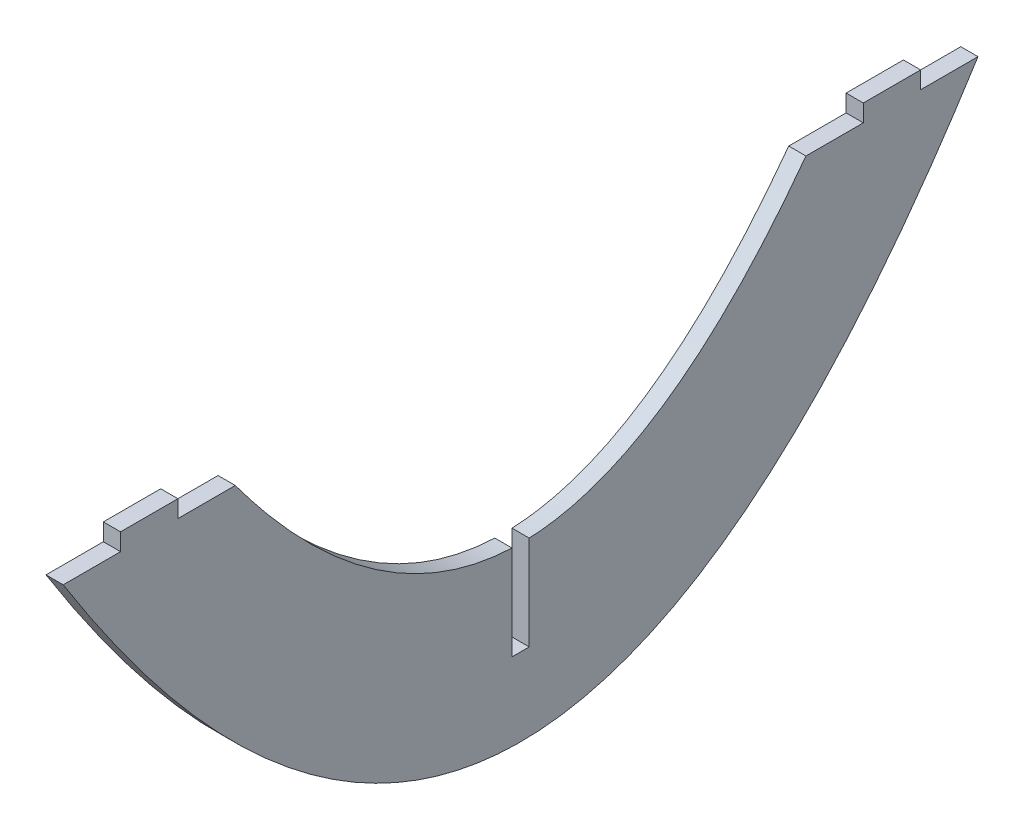
from build123d import *

# Parameters (mm, degrees)
EXTRUDE_1_DEPTH     = 3
EXTRUDE_2_DEPTH     = 3
CUT_EXTRUDE_1_DEPTH = 173.564004098


with BuildPart() as part:
    # 草图1 → 凸台-拉伸1 (new body)
    with BuildSketch(Plane(origin=(0, 0, 0), x_dir=(0, 0, -1), z_dir=(1, 0, 0))):
        with BuildLine():
            Line((-79.7507074, 150.000523308), (-49.751094174, 150.000523308))
            add(Edge.make_bspline(
                [(-49.751094174, 150.000523308), (0, 82.797016692), (49.751094174, 150.000523308)],
                knots=[0.222336685, 0.222336685, 0.222336685, 0.777663315, 0.777663315, 0.777663315], degree=2))
            Line((49.751094174, 150.000523308), (79.7507074, 150.000523308))
            add(Edge.make_bspline(
                [(-79.7507074, 150.000523308), (0, 22.797016692), (79.7507074, 150.000523308)],
                knots=[0.059549815, 0.059549815, 0.059549815, 0.940450185, 0.940450185, 0.940450185], degree=2))
        make_face()
    extrude(amount=EXTRUDE_1_DEPTH)

    # 草图2 → 凸台-拉伸2 (add)
    with BuildSketch(Plane(origin=(0, 150.000523308, 0), x_dir=(1, 0, 0), z_dir=(0, 1, 0))):
        Polygon((3, -59.750900787), (0.999993554, -59.750900787), (2.000006446, -69.750900787), (3, -69.750900787), align=None)
        Polygon((2.000006446, -69.750900787), (0.999993554, -59.750900787), (0, -59.750900787), (0, -69.750900787), align=None)
        Polygon((2.000006446, 59.750900787), (0.999993554, 69.750900787), (0, 69.750900787), (0, 59.750900787), align=None)
        Polygon((3, 69.750900787), (0.999993554, 69.750900787), (2.000006446, 59.750900787), (3, 59.750900787), align=None)
    extrude(amount=EXTRUDE_2_DEPTH)

    # 草图3 → 切除-拉伸1 (cut, through all)
    with BuildSketch(Plane.ZY):
        with BuildLine():
            Line((-1.5, 116.429314933), (-1.5, 99.990363817))
            Line((-1.5, 99.990363817), (1.5, 99.990363817))
            Line((1.5, 99.990363817), (1.5, 116.429314934))
            add(Edge.make_bspline(
                [(1.5, 116.429314934), (0, 116.368225067), (-1.5, 116.429314933)],
                knots=[0.491628426, 0.491628426, 0.491628426, 0.508371574, 0.508371574, 0.508371574], degree=2))
        make_face()
    extrude(amount=-CUT_EXTRUDE_1_DEPTH, mode=Mode.SUBTRACT)


solid = part.part
